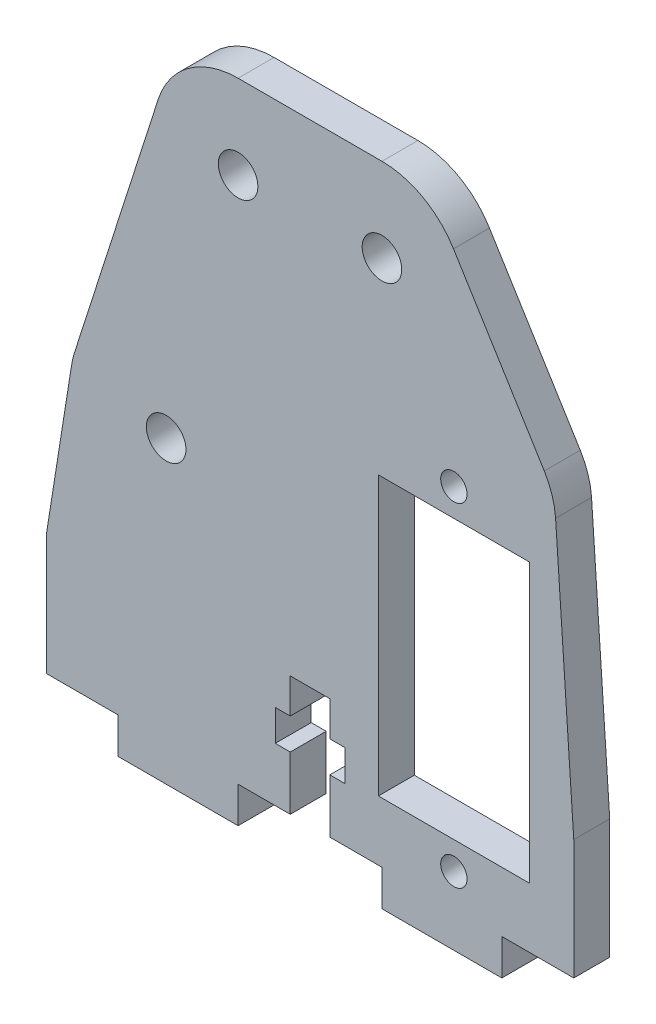
from build123d import *

# Parameters (mm, degrees)
ESKIZ_KONTUR_W        = 12.6
ESKIZ_KONTUR_H        = 23.2
PLASTINA_DEPTH        = 3
OTVERSTIYA_DEPTH      = 37.523967755
OTVERSTIYA_DEPTH_BACK = 37.523967755
ESKIZ_OTVERSTIYA_R    = 1.65
ESKIZ_OTVERSTIYA_R_2  = 1.1


with BuildPart() as part:
    # Eskiz_kontur → Plastina (new body)
    with BuildSketch(Plane.XY):
        with BuildLine():
            Line((-19.608453592, 2.472140862), (-12.657403592, 24.163120862))
            ThreePointArc((-12.657403592, 24.163120862), (-10.114503963, 27.663122227), (-6.000005728, 29.000003803))
            Line((-6.000005728, 29.000003803), (5.999994272, 29.000003803))
            ThreePointArc((5.999994272, 29.000003803), (9.420342449, 28.10747607), (11.968474679, 25.657494531))
            Line((11.968474679, 25.657494531), (19.542154679, 13.396244531))
            ThreePointArc((19.542154679, 13.396244531), (20.190566029, 11.981622791), (20.484159934, 10.453423012))
            Line((20.484159934, 10.453423012), (21.999989934, -11.999996988))
            Line((21.999989934, -11.999996988), (21.999989934, -22))
            Line((21.999989934, -22), (16, -22))
            Line((16, -22), (16, -25))
            Line((16, -25), (6, -25))
            Line((6, -25), (6, -22))
            Line((6, -22), (1.65, -22))
            Line((1.65, -22), (1.65, -17.5))
            Line((1.65, -17.5), (2.9, -17.5))
            Line((2.9, -17.5), (2.9, -14.9))
            Line((2.9, -14.9), (1.65, -14.9))
            Line((1.65, -14.9), (1.65, -12))
            Line((1.65, -12), (-1.65, -12))
            Line((-1.65, -12), (-1.65, -14.9))
            Line((-1.65, -14.9), (-2.9, -14.9))
            Line((-2.9, -14.9), (-2.9, -17.5))
            Line((-2.9, -17.5), (-1.65, -17.5))
            Line((-1.65, -17.5), (-1.65, -22))
            Line((-1.65, -22), (-6, -22))
            Line((-6, -22), (-6, -25))
            Line((-6, -25), (-16, -25))
            Line((-16, -25), (-16, -22))
            Line((-16, -22), (-22, -22))
            Line((-22, -22), (-22, -12))
            Line((-22, -12), (-19.90151, 1.25148))
            ThreePointArc((-19.90151, 1.25148), (-19.778961323, 1.867567439), (-19.608453592, 2.472140862))
        make_face()
        with Locations((12, -5.4)):
            Rectangle(ESKIZ_KONTUR_W, ESKIZ_KONTUR_H, mode=Mode.SUBTRACT)
    extrude(amount=PLASTINA_DEPTH)

    # Eskiz_otverstiya → Otverstiya (cut, two sides: drawn at the far end of the back side and taken through both)
    with BuildSketch(Plane.XY.offset(-OTVERSTIYA_DEPTH_BACK)):
        with Locations((-12, 0)):
            Circle(ESKIZ_OTVERSTIYA_R)
        with Locations((12, -19.3)):
            Circle(ESKIZ_OTVERSTIYA_R_2)
        with Locations((-6, 22)):
            Circle(ESKIZ_OTVERSTIYA_R)
        with Locations((12, 8.5)):
            Circle(ESKIZ_OTVERSTIYA_R_2)
        with Locations((6, 22)):
            Circle(ESKIZ_OTVERSTIYA_R)
    extrude(amount=OTVERSTIYA_DEPTH + OTVERSTIYA_DEPTH_BACK, mode=Mode.SUBTRACT)


solid = part.part
